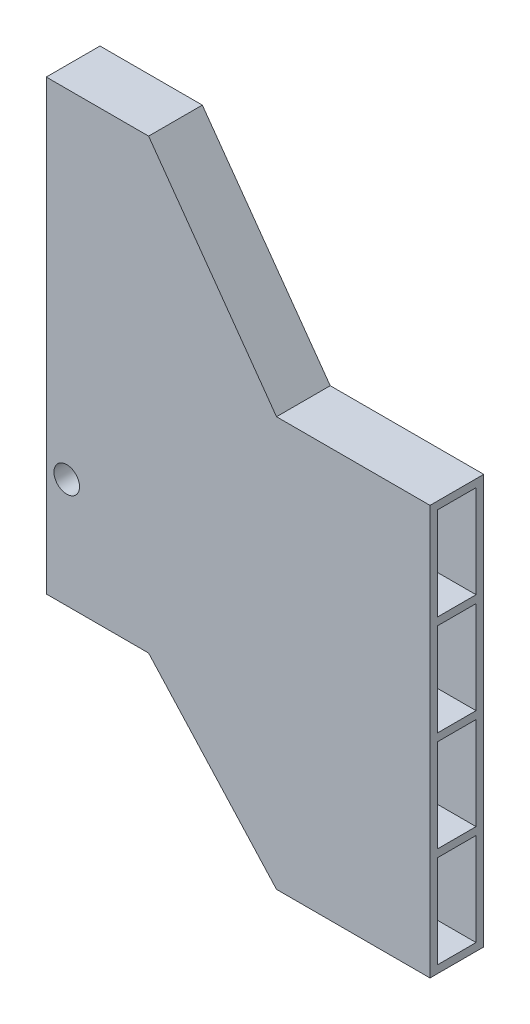
from build123d import *

# Parameters (mm, degrees)
SKETCH1_R           = 2.5
BOSS_EXTRUDE1_DEPTH = 1.5
BOSS_EXTRUDE2_START = 7.5
SKETCH1_13_R        = 2.5
BOSS_EXTRUDE2_DEPTH = 7.5
BOSS_EXTRUDE3_START = 9
SKETCH1_14_R        = 2.5
BOSS_EXTRUDE3_DEPTH = 1.5


with BuildPart() as part:
    # Sketch1 → Boss-Extrude1 (new body)
    with BuildSketch(Plane.XY):
        Polygon((0, 0), (20, 0), (45, -27.5), (75, -27.5), (75, 52.5), (45, 52.5), (20, 87.5), (0, 87.5), align=None)
        with Locations((4, 21.4)):
            Circle(SKETCH1_R, mode=Mode.SUBTRACT)
    extrude(amount=-BOSS_EXTRUDE1_DEPTH)

    # Sketch1<13> → Boss-Extrude2 (add)
    # profile 1 of 5: a face of its own
    with BuildSketch(Plane.XY.offset(BOSS_EXTRUDE2_START)):
        Polygon((0, 5.225), (0, 0), (20, 0), (45, -27.5), (75, -27.5), (75, -26), (45, -26), (20, 1.5), align=None)
    # profile 2 of 5: a face of its own
    with BuildSketch(Plane.XY.offset(BOSS_EXTRUDE2_START)):
        Polygon((0, 27.575), (0, 15.225), (20, 18.95), (45, -7.875), (75, -7.875), (75, -6.375), (45, -6.375), (20, 23.85), align=None)
        with Locations((4, 21.4)):
            Circle(SKETCH1_13_R, mode=Mode.SUBTRACT)
    # profile 3 of 5: a face of its own
    with BuildSketch(Plane.XY.offset(BOSS_EXTRUDE2_START)):
        Polygon((0, 49.925), (0, 37.575), (20, 41.3), (45, 11.75), (75, 11.75), (75, 13.25), (45, 13.25), (20, 46.2), align=None)
    # profile 4 of 5: a face of its own
    with BuildSketch(Plane.XY.offset(BOSS_EXTRUDE2_START)):
        Polygon((0, 72.275), (0, 59.925), (20, 63.65), (45, 31.375), (75, 31.375), (75, 32.875), (45, 32.875), (20, 68.55), align=None)
    # profile 5 of 5: a face of its own
    with BuildSketch(Plane.XY.offset(BOSS_EXTRUDE2_START)):
        Polygon((0, 87.5), (0, 82.275), (20, 86), (45, 51), (75, 51), (75, 52.5), (45, 52.5), (20, 87.5), align=None)
    extrude(amount=-BOSS_EXTRUDE2_DEPTH)

    # Sketch1<14> → Boss-Extrude3 (add)
    with BuildSketch(Plane.XY.offset(BOSS_EXTRUDE3_START)):
        Polygon((0, 0), (20, 0), (45, -27.5), (75, -27.5), (75, 52.5), (45, 52.5), (20, 87.5), (0, 87.5), align=None)
        with Locations((4, 21.4)):
            Circle(SKETCH1_14_R, mode=Mode.SUBTRACT)
    extrude(amount=-BOSS_EXTRUDE3_DEPTH)


solid = part.part
